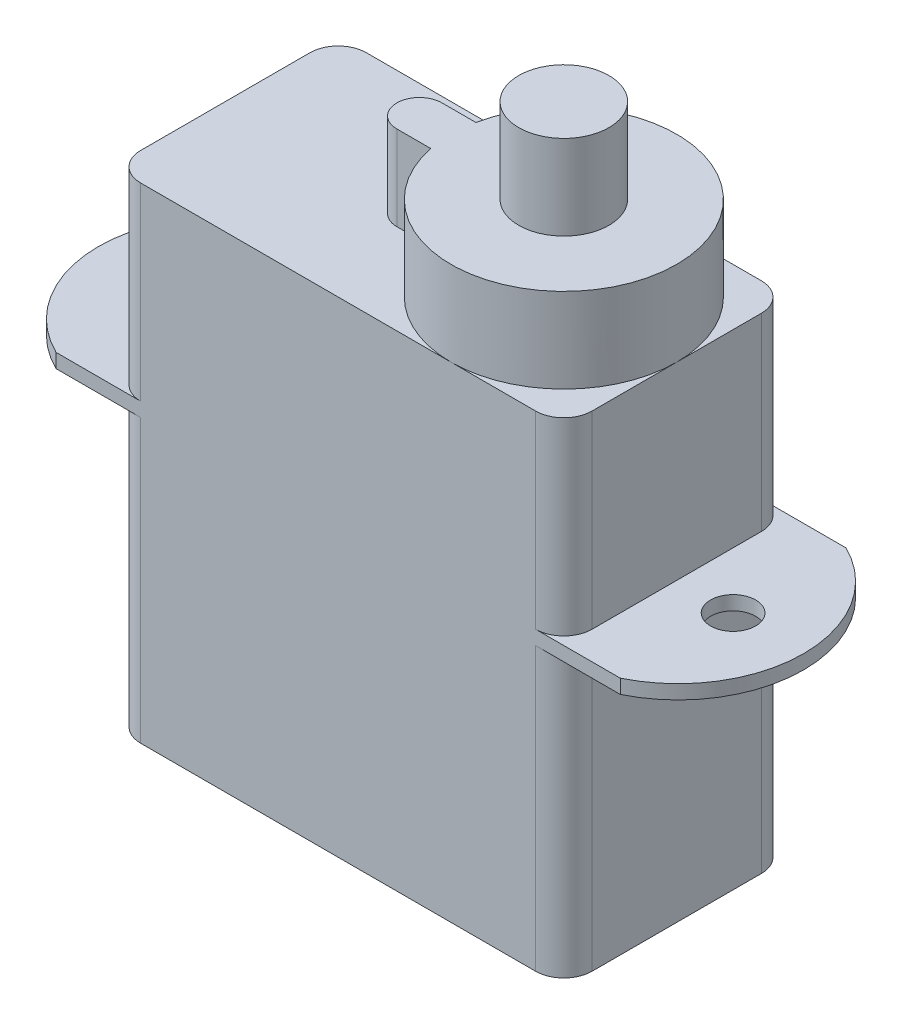
from build123d import *

# Parameters (mm, degrees)
EXTRUDE_1_DEPTH = 10
SKETCH_2_R      = 0.8
EXTRUDE_2_DEPTH = 0.5
EXTRUDE_3_DEPTH = 6.7
EXTRUDE_4_DEPTH = 3
SKETCH_5_R      = 1.6
EXTRUDE_5_DEPTH = 3


with BuildPart() as part:
    # 草图1 → 凸台-拉伸1 (new body)
    with BuildSketch(Plane(origin=(0, 0, 0), x_dir=(1, 0, 0), z_dir=(0, 1, 0))):
        with BuildLine():
            Line((-7, -4), (7, -4))
            ThreePointArc((7, -4), (7.707106781, -3.707106781), (8, -3))
            Line((8, -3), (8, 3))
            ThreePointArc((8, 3), (7.707106781, 3.707106781), (7, 4))
            Line((7, 4), (-7, 4))
            ThreePointArc((-7, 4), (-7.707106781, 3.707106781), (-8, 3))
            Line((-8, 3), (-8, -3))
            ThreePointArc((-8, -3), (-7.707106781, -3.707106781), (-7, -4))
        make_face()
    extrude(amount=EXTRUDE_1_DEPTH)

    # 草图2 → 凸台-拉伸2 (add)
    with BuildSketch(Plane(origin=(0, 10, 0), x_dir=(1, 0, 0), z_dir=(0, 1, 0))):
        with BuildLine():
            Line((-10, -4), (10, -4))
            ThreePointArc((10, -4), (12.5, 0), (10, 4))
            Line((10, 4), (-10, 4))
            ThreePointArc((-10, 4), (-12.5, 0), (-10, -4))
        make_face()
        with Locations(Location((-10, 0, 0), (0, 0, 270))):
            Circle(SKETCH_2_R, mode=Mode.SUBTRACT)
        with Locations(Location((10, 0, 0), (0, 0, 90))):
            Circle(SKETCH_2_R, mode=Mode.SUBTRACT)
    extrude(amount=EXTRUDE_2_DEPTH)

    # 草图3 → 凸台-拉伸3 (add)
    with BuildSketch(Plane(origin=(0, 10.5, 0), x_dir=(1, 0, 0), z_dir=(0, 1, 0))):
        with BuildLine():
            Line((7, 4), (-7, 4))
            ThreePointArc((-7, 4), (-7.707106781, 3.707106781), (-8, 3))
            Line((-8, 3), (-8, -3))
            ThreePointArc((-8, -3), (-7.707106781, -3.707106781), (-7, -4))
            Line((-7, -4), (7, -4))
            ThreePointArc((7, -4), (7.707106781, -3.707106781), (8, -3))
            Line((8, -3), (8, 3))
            ThreePointArc((8, 3), (7.707106781, 3.707106781), (7, 4))
        make_face()
    extrude(amount=EXTRUDE_3_DEPTH)

    # 草图4 → 凸台-拉伸4 (add)
    with BuildSketch(Plane(origin=(0, 17.2, 0), x_dir=(1, 0, 0), z_dir=(0, 1, 0))):
        with BuildLine():
            Line((-1.119183588, 0.8), (0.080816412, 0.8))
            ThreePointArc((0.080816412, 0.8), (8, 0), (0.080816412, -0.8))
            Line((0.080816412, -0.8), (-1.119183588, -0.8))
            ThreePointArc((-1.119183588, -0.8), (-1.919183588, 0), (-1.119183588, 0.8))
        make_face()
    extrude(amount=EXTRUDE_4_DEPTH)

    # 草图5 → 凸台-拉伸5 (add)
    with BuildSketch(Plane(origin=(0, 20.2, 0), x_dir=(1, 0, 0), z_dir=(0, 1, 0))):
        with Locations(Location((4, 0, 0), (0, 0, 270))):
            Circle(SKETCH_5_R)
    extrude(amount=EXTRUDE_5_DEPTH)


solid = part.part
